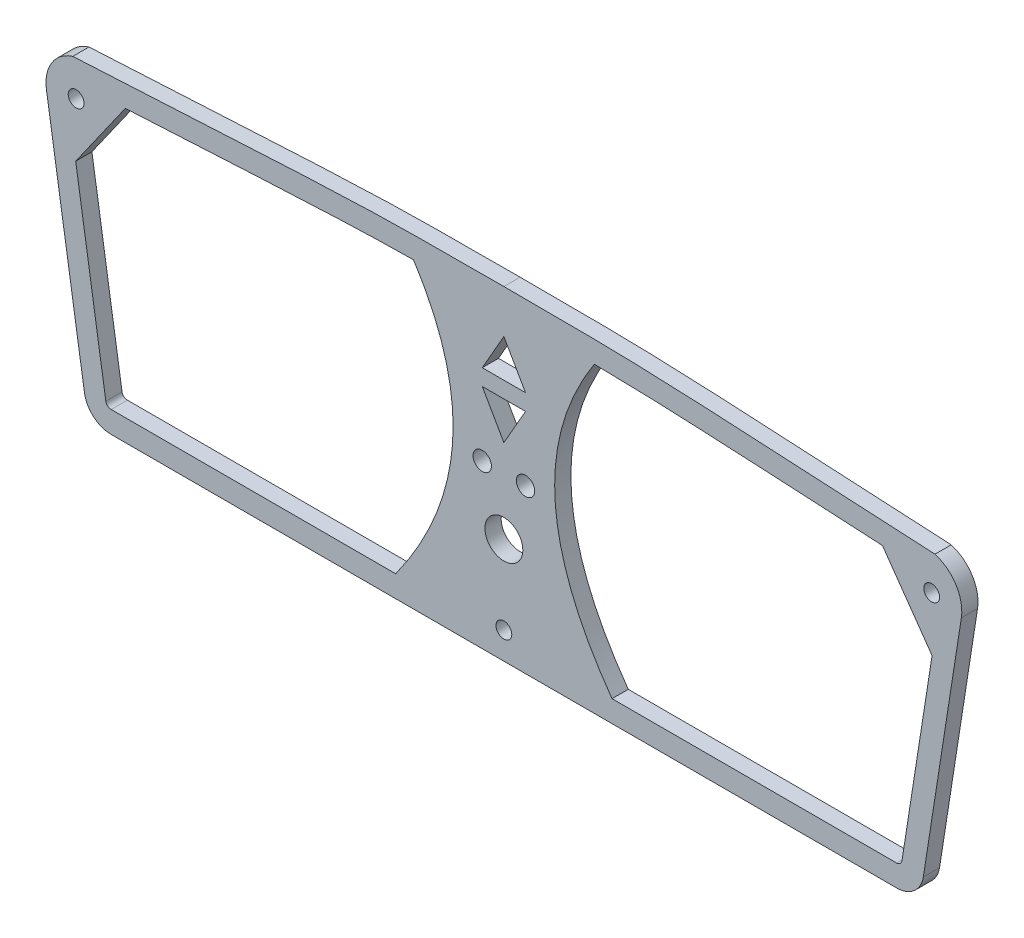
from build123d import *

# Parameters (mm, degrees)
SALIENTE_EXTRUIR3_DEPTH      = 3
CORTAR_EXTRUIR2_DEPTH        = 3
TALADRO_DE_MARGEN_PARA_31_D  = 2.921
CORTAR_EXTRUIR3_DEPTH        = 3
TALADRO_DE_MARGEN_PARA_M31_D = 3.4
CROQUIS11_R                  = 3.5
CORTAR_EXTRUIR4_DEPTH        = 4


with BuildPart() as part:
    # Croquis1 → Saliente-Extruir3 (new body)
    with BuildSketch(Plane.XY):
        with BuildLine():
            Line((72.6209879, -42.713924632), (-72.6209879, -42.713924632))
            ThreePointArc((-72.6209879, -42.713924632), (-75.872299777, -41.512473181), (-77.561094305, -38.485513064))
            Line((-77.561094305, -38.485513064), (-84.58908741, 6.511317248))
            ThreePointArc((-84.58908741, 6.511317248), (-83.604933224, 11.307915351), (-79.718228228, 14.286075368))
            add(Edge.make_bspline(
                [(-79.718228228, 14.286075368), (-25, 17.286075368), (0, 17.286075368)],
                knots=[0, 0, 0, 1, 1, 1], degree=2, weights=[1, 3, 1]))
            add(Edge.make_bspline(
                [(79.718228228, 14.286075368), (25, 17.286075368), (0, 17.286075368)],
                knots=[0, 0, 0, 1, 1, 1], degree=2, weights=[1, 3, 1]))
            ThreePointArc((79.718228228, 14.286075368), (83.604933224, 11.307915351), (84.58908741, 6.511317248))
            Line((84.58908741, 6.511317248), (77.561094305, -38.485513064))
            ThreePointArc((77.561094305, -38.485513064), (75.872299777, -41.512473181), (72.6209879, -42.713924632))
        make_face()
    extrude(amount=SALIENTE_EXTRUIR3_DEPTH)

    # Croquis10 → Cortar-Extruir2 (cut)
    with BuildSketch(Plane(origin=(0, 0, 0), x_dir=(-1, 0, 0), z_dir=(0, 0, -1))):
        with BuildLine():
            add(Edge.make_bspline(
                [(20, -38.713924632), (0.559455018, -11.654526177), (16.7386853, 13.210639363)],
                knots=[0, 0, 0, 0.99205849, 0.99205849, 0.99205849], degree=2))
            Line((20, -38.713924632), (72.6209879, -38.713924632))
            ThreePointArc((72.6209879, -38.713924632), (73.271250275, -38.473634342), (73.609009181, -37.868242318))
            Line((73.609009181, -37.868242318), (79.176075372, -2.225018285))
            Line((79.176075372, -2.225018285), (70, 10.811605693))
            add(Edge.make_bspline(
                [(70, 10.811605693), (66.398209009, 11.007964388), (62.796370304, 11.203428352), (52.622201432, 11.751277545), (46.049858241, 12.103432641), (36.189081361, 12.589204947), (32.901882837, 12.743822313), (26.325619707, 13.003093268), (23.036367807, 13.1028135), (18.743362502, 13.182321556), (17.741031709, 13.197739044), (16.7386853, 13.210639363)],
                knots=[0.112987579, 0.112987579, 0.112987579, 0.112987579, 0.25, 0.25, 0.5, 0.5, 0.625, 0.625, 0.75, 0.75, 0.788073704, 0.788073704, 0.788073704, 0.788073704], degree=3))
        make_face()
        with BuildLine():
            Line((-70, 10.811605693), (-79.176075372, -2.225018285))
            Line((-79.176075372, -2.225018285), (-73.609009181, -37.868242318))
            ThreePointArc((-73.609009181, -37.868242318), (-73.271250275, -38.473634342), (-72.6209879, -38.713924632))
            Line((-72.6209879, -38.713924632), (-20, -38.713924632))
            add(Edge.make_bspline(
                [(-20, -38.713924632), (-0.559455021, -11.654526182), (-16.738685294, 13.210639354)],
                knots=[0, 0, 0, 0.99205849, 0.99205849, 0.99205849], degree=2))
            add(Edge.make_bspline(
                [(-16.738685294, 13.210639354), (-17.741034914, 13.197738997), (-18.743368579, 13.182321461), (-23.036374427, 13.10281332), (-26.325620803, 13.003093227), (-32.901882392, 12.743822329), (-36.189082451, 12.589204896), (-46.04985995, 12.103432552), (-52.622202183, 11.751277505), (-62.796370664, 11.203428332), (-66.398209188, 11.007964378), (-70, 10.811605693)],
                knots=[0.211926193, 0.211926193, 0.211926193, 0.211926193, 0.25, 0.25, 0.375, 0.375, 0.5, 0.5, 0.75, 0.75, 0.887012418, 0.887012418, 0.887012418, 0.887012418], degree=3))
        make_face()
    extrude(amount=-CORTAR_EXTRUIR2_DEPTH, mode=Mode.SUBTRACT)

    # Taladro de margen para #31 (through all)
    with Locations(Plane(origin=(79.096485455, 7.800604527, 3), x_dir=(1, 0, 0), z_dir=(0, 0, 1))):
        with Locations((0, 0), (-158.19297091, 0), (-79.096485455, -45.514529159)):
            Hole(TALADRO_DE_MARGEN_PARA_31_D / 2)

    # Croquis14 → Cortar-Extruir3 (cut)
    with BuildSketch(Plane.XY.offset(3)):
        Polygon((4, 2.286075368), (-4, 2.286075368), (0, 9.286075368), align=None)
        Polygon((0, -7.713924632), (4, -0.713924632), (-4, -0.713924632), align=None)
    extrude(amount=-CORTAR_EXTRUIR3_DEPTH, mode=Mode.SUBTRACT)

    # Taladro de margen para M31 (through all)
    with Locations(Plane(origin=(-4, -12.638714265, 3), x_dir=(1, 0, 0), z_dir=(0, 0, 1))):
        with Locations((0, 0), (8, 0)):
            Hole(TALADRO_DE_MARGEN_PARA_M31_D / 2)

    # Croquis11 → Cortar-Extruir4 (cut)
    with BuildSketch(Plane.XY.offset(3)):
        with Locations((0, -23.173641151)):
            Circle(CROQUIS11_R)
    extrude(amount=-CORTAR_EXTRUIR4_DEPTH, mode=Mode.SUBTRACT)


solid = part.part
